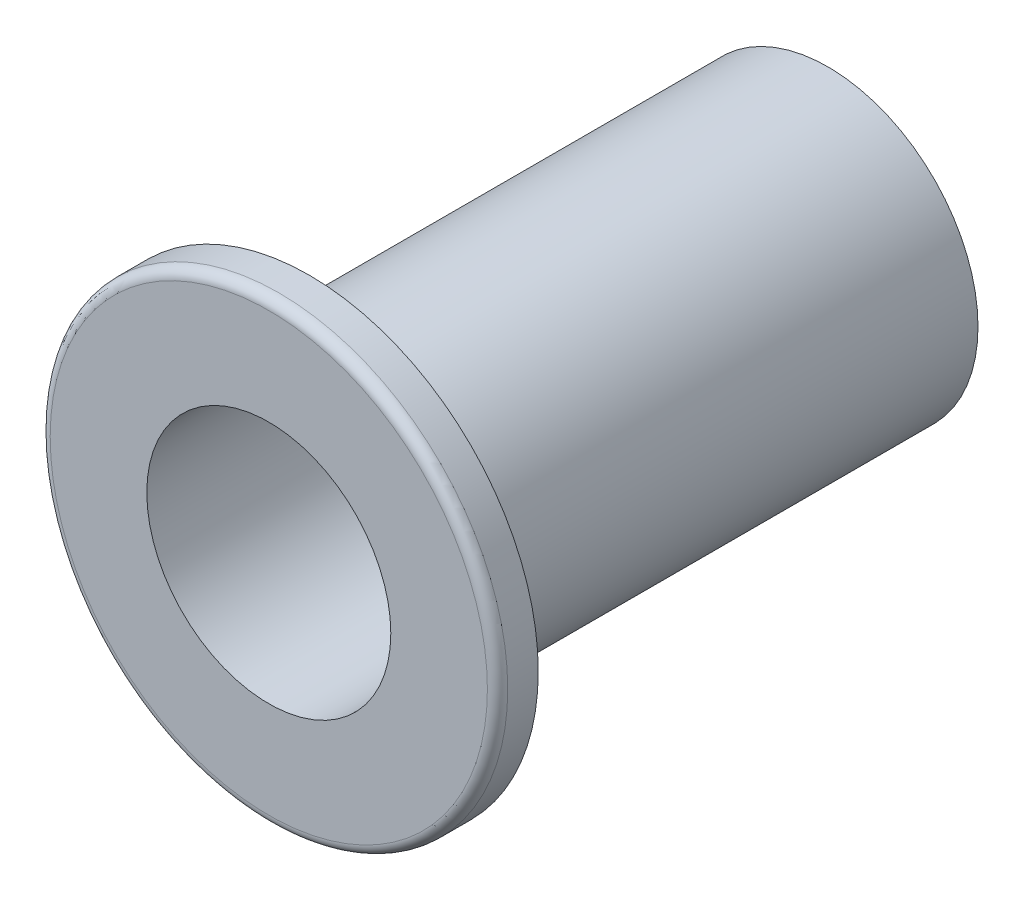
from build123d import *

# Parameters (mm, degrees)
FILLET_1_R = 0.2


with BuildPart() as part:
    # 草图1 → 旋转1 (revolve)
    with BuildSketch(Plane(origin=(0, 0, 0), x_dir=(0, 0, -1), z_dir=(1, 0, 0)), mode=Mode.PRIVATE) as revolve_1_sk:
        Polygon((0, 2.95), (0, 4.5), (-0.8, 4.5), (-0.8, 2.4), (4.2, 2.4), (4.2, 2), (10.2, 2), (10.2, 2.95), align=None)
    revolve(revolve_1_sk.sketch.rotate(Axis((0, 0, 0), (0, 0, -1)), 90), axis=Axis((0, 0, 0), (0, 0, -1)))

    # 圆角1
    fillet_1_edges = [part.edges().sort_by_distance(p)[0] for p in [
        (-4.5, 0, 0.8),
    ]]
    fillet(fillet_1_edges, radius=FILLET_1_R)


solid = part.part
